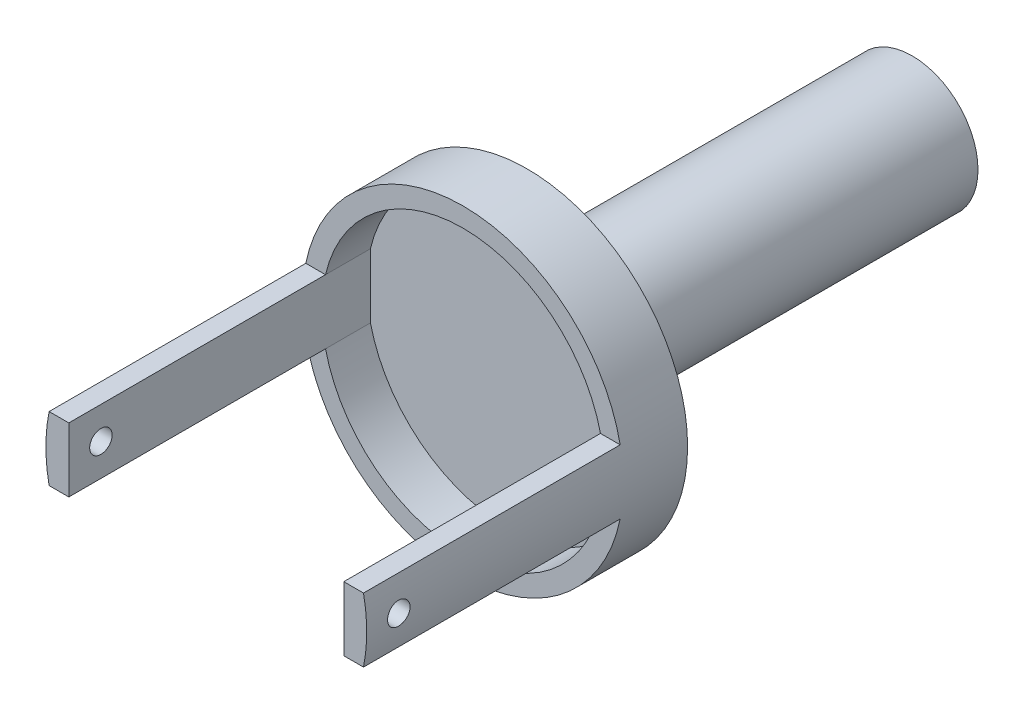
from build123d import *

# Parameters (mm, degrees)
SKETCH1_R                           = 25
SKETCH1_R_2                         = 22
BOSS_EXTRUDE1_DEPTH                 = 10
SKETCH1_2_R                         = 22
BOSS_EXTRUDE2_DEPTH                 = 3
BOSS_EXTRUDE3_START                 = -7
BOSS_EXTRUDE3_DEPTH                 = 7
BOSS_EXTRUDE4_DEPTH                 = 40
CUT_EXTRUDE1_REACH                  = 74.665
CUT_EXTRUDE1_END_RADIUS             = 25
SKETCH3_R                           = 1.75
CUT_EXTRUDE1_DIRECTION_2_REACH      = 74.665
CUT_EXTRUDE1_DIRECTION_2_END_RADIUS = 25
SKETCH4_R                           = 10.25
SKETCH4_R_2                         = 8.25
BOSS_EXTRUDE5_DEPTH                 = 60
SKETCH4_2_R                         = 8.25
BOSS_EXTRUDE6_DEPTH                 = 44


with BuildPart() as part:
    # Sketch1 → Boss-Extrude1 (new body)
    with BuildSketch(Plane.XY):
        Circle(SKETCH1_R)
        Circle(SKETCH1_R_2, mode=Mode.SUBTRACT)
    extrude(amount=BOSS_EXTRUDE1_DEPTH)

    # Sketch1<2> → Boss-Extrude2 (add)
    with BuildSketch(Plane.XY):
        Circle(SKETCH1_2_R)
    extrude(amount=BOSS_EXTRUDE2_DEPTH)

    # Sketch2 → Boss-Extrude3 (add)
    with BuildSketch(Plane.XY.offset(10).offset(BOSS_EXTRUDE3_START)):
        with BuildLine():
            Line((-21.424285286, -5), (-21.424285286, 5))
            ThreePointArc((-21.424285286, 5), (-22, 0), (-21.424285286, -5))
        make_face()
        with BuildLine():
            ThreePointArc((22, 0), (21.85559741, 2.516517804), (21.424285286, 5))
            Line((21.424285286, 5), (21.424285286, -5))
            ThreePointArc((21.424285286, -5), (21.85559741, -2.516517804), (22, 0))
        make_face()
    extrude(amount=BOSS_EXTRUDE3_DEPTH)

    # Sketch2<4> → Boss-Extrude4 (add)
    with BuildSketch(Plane.XY.offset(10)):
        with BuildLine():
            Line((-21.424285286, 5), (-24.494897428, 5))
            ThreePointArc((-24.494897428, 5), (-25, 0), (-24.494897428, -5))
            Line((-24.494897428, -5), (-21.424285286, -5))
            Line((-21.424285286, -5), (-21.424285286, 5))
        make_face()
        with BuildLine():
            Line((24.494897428, 5), (21.424285286, 5))
            Line((21.424285286, 5), (21.424285286, -5))
            Line((21.424285286, -5), (24.494897428, -5))
            ThreePointArc((24.494897428, -5), (25, 0), (24.494897428, 5))
        make_face()
    extrude(amount=BOSS_EXTRUDE4_DEPTH)

    # Cut-Extrude1: up to this cylinder (the profile starts inside it)
    cut_extrude1_end = Plane(origin=(0, 0, 45), z_dir=(0, 0, -1)) * Cylinder(CUT_EXTRUDE1_END_RADIUS, 200.33, mode=Mode.PRIVATE)
    # Sketch3 → Cut-Extrude1 (cut, up to the surface)
    with BuildSketch(Plane(origin=(-21.424285286, 0, 0), x_dir=(0, 0, -1), z_dir=(1, 0, 0)), mode=Mode.PRIVATE) as cut_extrude1_sk1:
        with Locations(Location((-45, 0, 0), (0, 0, 90))):
            Circle(SKETCH3_R)
    cut_extrude1_tool1 = extrude(cut_extrude1_sk1.sketch, amount=-CUT_EXTRUDE1_REACH, mode=Mode.PRIVATE) & cut_extrude1_end
    add(cut_extrude1_tool1.solids().sort_by_distance((-21.424285, 0, 45))[0], mode=Mode.SUBTRACT)

    # Cut-Extrude1 direction 2: up to this cylinder (the profile starts inside it)
    cut_extrude1_direction_2_end = Plane(origin=(0, 0, 45), z_dir=(0, 0, -1)) * Cylinder(CUT_EXTRUDE1_DIRECTION_2_END_RADIUS, 200.33, mode=Mode.PRIVATE)
    # Sketch3 → Cut-Extrude1 direction 2 (cut, up to the surface)
    with BuildSketch(Plane(origin=(-21.424285286, 0, 0), x_dir=(0, 0, -1), z_dir=(1, 0, 0)), mode=Mode.PRIVATE) as cut_extrude1_direction_2_sk1:
        with Locations(Location((-45, 0, 0), (0, 0, 90))):
            Circle(SKETCH3_R)
    cut_extrude1_direction_2_tool1 = extrude(cut_extrude1_direction_2_sk1.sketch, amount=CUT_EXTRUDE1_DIRECTION_2_REACH, mode=Mode.PRIVATE) & cut_extrude1_direction_2_end
    add(cut_extrude1_direction_2_tool1.solids().sort_by_distance((-21.424285, 0, 45))[0], mode=Mode.SUBTRACT)

    # Sketch4 → Boss-Extrude5 (add)
    with BuildSketch(Plane(origin=(0, 0, 0), x_dir=(-1, 0, 0), z_dir=(0, 0, -1))):
        with Locations(Location((0, 0, 0), (0, 0, 180))):
            Circle(SKETCH4_R)
        Circle(SKETCH4_R_2, mode=Mode.SUBTRACT)
    extrude(amount=BOSS_EXTRUDE5_DEPTH)

    # Sketch4<2> → Boss-Extrude6 (add)
    with BuildSketch(Plane(origin=(0, 0, 0), x_dir=(-1, 0, 0), z_dir=(0, 0, -1))):
        Circle(SKETCH4_2_R)
    extrude(amount=BOSS_EXTRUDE6_DEPTH)


solid = part.part
